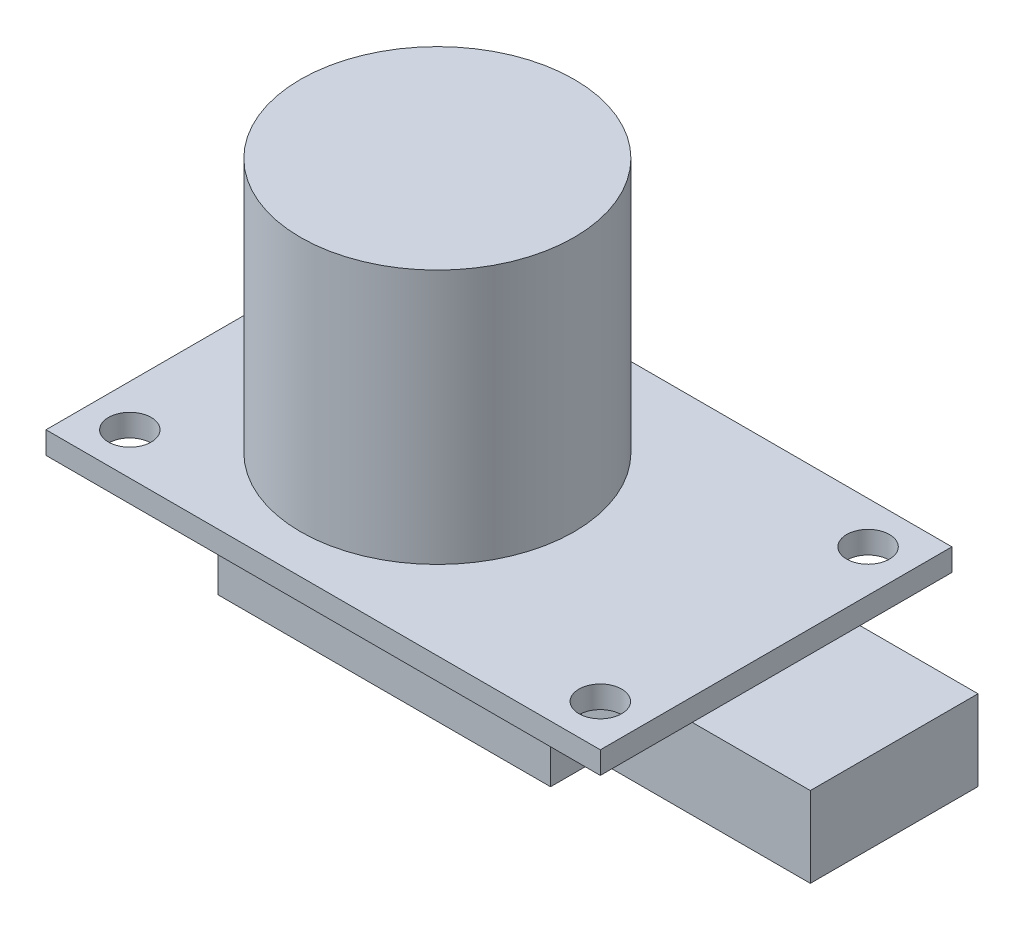
from build123d import *

# Parameters (mm, degrees)
SKETCH1_W           = 32.4
SKETCH1_H           = 20.55
SKETCH1_R           = 1.25
BOSS_EXTRUDE1_DEPTH = 1.3
SKETCH2_R           = 8
BOSS_EXTRUDE2_DEPTH = 14.9
SKETCH3_W           = 19.437089118
SKETCH3_H           = 13.404889048
BOSS_EXTRUDE3_DEPTH = 5.6
SKETCH4_W           = 13.8
SKETCH4_H           = 9.8
BOSS_EXTRUDE4_DEPTH = 4.7


with BuildPart() as part:
    # Sketch1 → Boss-Extrude1 (new body)
    with BuildSketch(Plane(origin=(0, 0, 0), x_dir=(1, 0, 0), z_dir=(0, 1, 0))):
        Rectangle(SKETCH1_W, SKETCH1_H)
        with Locations(Location((-13.75, 7.825, 0), (0, 0, 270))):
            Circle(SKETCH1_R, mode=Mode.SUBTRACT)
        with Locations(Location((-13.75, -7.825, 0), (0, 0, 90))):
            Circle(SKETCH1_R, mode=Mode.SUBTRACT)
        with Locations(Location((13.75, -7.825, 0), (0, 0, 270))):
            Circle(SKETCH1_R, mode=Mode.SUBTRACT)
        with Locations(Location((13.75, 7.825, 0), (0, 0, 90))):
            Circle(SKETCH1_R, mode=Mode.SUBTRACT)
    extrude(amount=BOSS_EXTRUDE1_DEPTH)

    # Sketch2 → Boss-Extrude2 (add)
    with BuildSketch(Plane(origin=(0, 1.3, 0), x_dir=(1, 0, 0), z_dir=(0, 1, 0))):
        with Locations(Location((-3.6, 0, 0), (0, 0, 270))):
            Circle(SKETCH2_R)
    extrude(amount=BOSS_EXTRUDE2_DEPTH)

    # Sketch3 → Boss-Extrude3 (add)
    with BuildSketch(Plane.XZ):
        Rectangle(SKETCH3_W, SKETCH3_H)
    extrude(amount=BOSS_EXTRUDE3_DEPTH)

    # Sketch4 → Boss-Extrude4 (add)
    with BuildSketch(Plane.XZ):
        with Locations((16.2, 0)):
            Rectangle(SKETCH4_W, SKETCH4_H)
    extrude(amount=BOSS_EXTRUDE4_DEPTH)


solid = part.part
